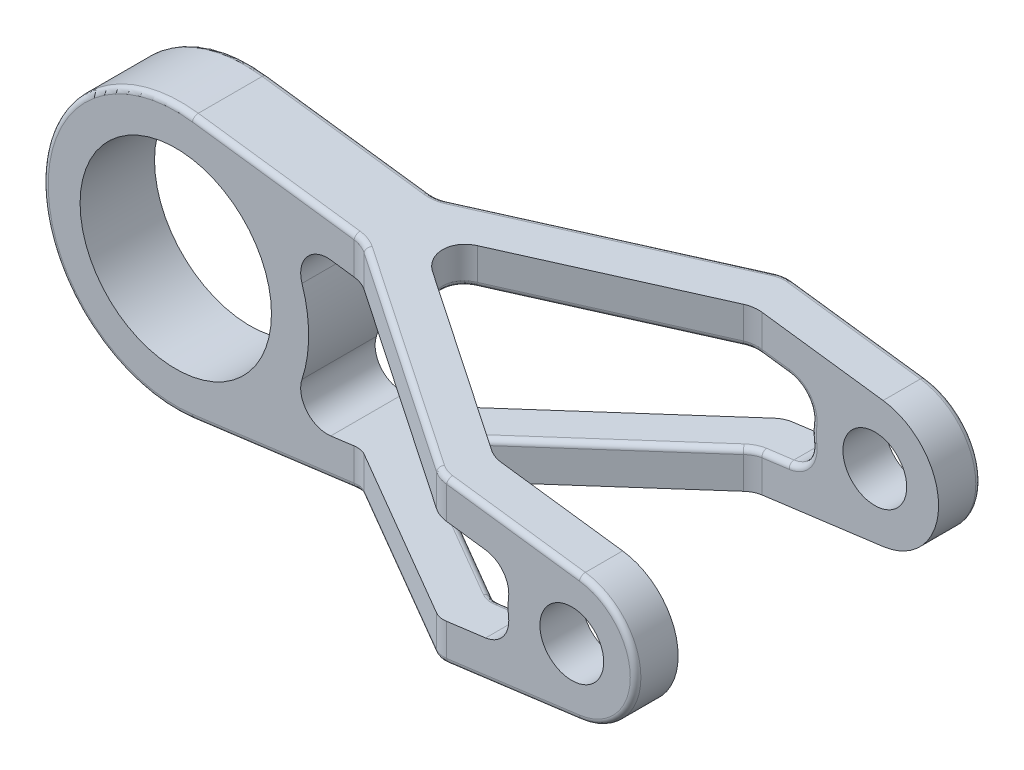
from build123d import *

# Parameters (mm, degrees)
SKETCH2_R           = 6
SKETCH2_R_2         = 18
BOSS_EXTRUDE1_DEPTH = 32.5
SKETCH3_OUTSIDE_W   = 170.934
SKETCH3_OUTSIDE_H   = 98.934
CUT_EXTRUDE2_DEPTH  = 40
FILLET1_R           = 1


with BuildPart() as part:
    # Sketch2 → Boss-Extrude1 (new, symmetric)
    with BuildSketch(Plane.XY):
        with BuildLine():
            Line((3.25, 24.787849846), (101.56, 11.898167926))
            ThreePointArc((101.56, 11.898167926), (112, 0), (101.56, -11.898167926))
            Line((101.56, -11.898167926), (3.25, -24.787849846))
            ThreePointArc((3.25, -24.787849846), (-25, 0), (3.25, 24.787849846))
        make_face()
        with Locations((100, 0)):
            Circle(SKETCH2_R, mode=Mode.SUBTRACT)
        Circle(SKETCH2_R_2, mode=Mode.SUBTRACT)
        with BuildLine():
            Line((29.147575422, 14.332440372), (83.794262105, 7.167569969))
            ThreePointArc((83.794262105, 7.167569969), (87.109412856, 5.255911936), (88.101832074, 1.56))
            ThreePointArc((88.101832074, 1.56), (88, 0), (88.101832074, -1.56))
            ThreePointArc((88.101832074, -1.56), (87.109412856, -5.255911936), (83.794262105, -7.167569969))
            Line((83.794262105, -7.167569969), (29.147575422, -14.332440372))
            ThreePointArc((29.147575422, -14.332440372), (24.646675614, -12.564003619), (23.747979518, -7.812392003))
            ThreePointArc((23.747979518, -7.812392003), (25, 0), (23.747979518, 7.812392003))
            ThreePointArc((23.747979518, 7.812392003), (24.646675614, 12.564003619), (29.147575422, 14.332440372))
        make_face(mode=Mode.SUBTRACT)
    extrude(amount=BOSS_EXTRUDE1_DEPTH, both=True)

    # Sketch3 outside → Cut-Extrude2 (cut, symmetric)
    with BuildSketch(Plane(origin=(0, 0, 0), x_dir=(1, 0, 0), z_dir=(0, 1, 0))):
        with Locations((43.5, 0)):
            Rectangle(SKETCH3_OUTSIDE_W, SKETCH3_OUTSIDE_H)
        with BuildLine():
            Line((-25, 7), (33.54180391, 7))
            ThreePointArc((33.54180391, 7), (34.941682484, 7.199964586), (36.229590603, 7.78386401))
            Line((36.229590603, 7.78386401), (73.770409397, 31.71613599))
            ThreePointArc((73.770409397, 31.71613599), (75.058317516, 32.300035414), (76.45819609, 32.5))
            Line((76.45819609, 32.5), (112, 32.5))
            Line((112, 32.5), (112, 24.5))
            Line((112, 24.5), (78.791309835, 24.5))
            ThreePointArc((78.791309835, 24.5), (77.39143126, 24.300035414), (76.103523141, 23.71613599))
            Line((76.103523141, 23.71613599), (45.515287847, 4.21613599))
            ThreePointArc((45.515287847, 4.21613599), (43.203074541, 0), (45.515287847, -4.21613599))
            Line((45.515287847, -4.21613599), (76.103523141, -23.71613599))
            ThreePointArc((76.103523141, -23.71613599), (77.39143126, -24.300035414), (78.791309835, -24.5))
            Line((78.791309835, -24.5), (112, -24.5))
            Line((112, -24.5), (112, -32.5))
            Line((112, -32.5), (76.45819609, -32.5))
            ThreePointArc((76.45819609, -32.5), (75.058317516, -32.300035414), (73.770409397, -31.71613599))
            Line((73.770409397, -31.71613599), (36.229590603, -7.78386401))
            ThreePointArc((36.229590603, -7.78386401), (34.941682484, -7.199964586), (33.54180391, -7))
            Line((33.54180391, -7), (-25, -7))
            Line((-25, -7), (-25, 7))
        make_face(mode=Mode.SUBTRACT)
    extrude(amount=CUT_EXTRUDE2_DEPTH, both=True, mode=Mode.SUBTRACT)

    # Fillet1
    fillet1_edges = [part.edges().sort_by_distance(p)[0] for p in [
        (75.059173459, 15.372760793, -32.300284958),
        (77.392287204, 8.006949688, -24.300284958),
        (60.809405494, 10.181174798, -13.96613599),
        (43.203074541, 12.489587022, 0),
        (60.809405494, 10.181174798, 13.96613599),
        (77.392287204, 8.006949688, 24.300284958),
        (75.059173459, 15.372760793, 32.300284958),
        (55, 18.002771631, 19.75),
        (34.940826541, 20.632782469, 7.199715042),
        (81.29278597, -7.495545065, -24.5),
        (87.109412856, -5.255911936, -24.5),
        (88, 0, -24.5),
        (87.109412856, 5.255911936, -24.5),
        (81.29278597, 7.495545065, -24.5),
        (81.29278597, 7.495545065, 24.5),
        (87.109412856, 5.255911936, 24.5),
        (88, 0, 24.5),
        (87.109412856, -5.255911936, 24.5),
        (81.29278597, -7.495545065, 24.5),
        (18.395901955, -22.802030921, -7),
        (-25, 0, -7),
        (-25, 0, 7),
        (18.395901955, -22.802030921, 7),
        (18.395901955, 22.802030921, -7),
        (34.940826541, -20.632782469, -7.199715042),
        (55, -18.002771631, -19.75),
        (75.059173459, -15.372760793, -32.300284958),
        (112, 0, 32.5),
        (75.059173459, -15.372760793, 32.300284958),
        (55, -18.002771631, 19.75),
        (34.940826541, -20.632782469, 7.199715042),
        (18.395901955, 22.802030921, 7),
        (89.009098045, 13.543749597, 32.5),
        (89.009098045, 13.543749597, -32.5),
        (112, 0, -32.5),
        (77.392287204, -8.006949688, 24.300284958),
        (60.809405494, -10.181174798, 13.96613599),
        (43.203074541, -12.489587022, 0),
        (60.809405494, -10.181174798, -13.96613599),
        (77.392287204, -8.006949688, -24.300284958),
        (89.009098045, -13.543749597, -32.5),
        (89.009098045, -13.543749597, 32.5),
        (34.940826541, 20.632782469, -7.199715042),
        (55, 18.002771631, -19.75),
    ]]
    fillet(fillet1_edges, radius=FILLET1_R)


solid = part.part
